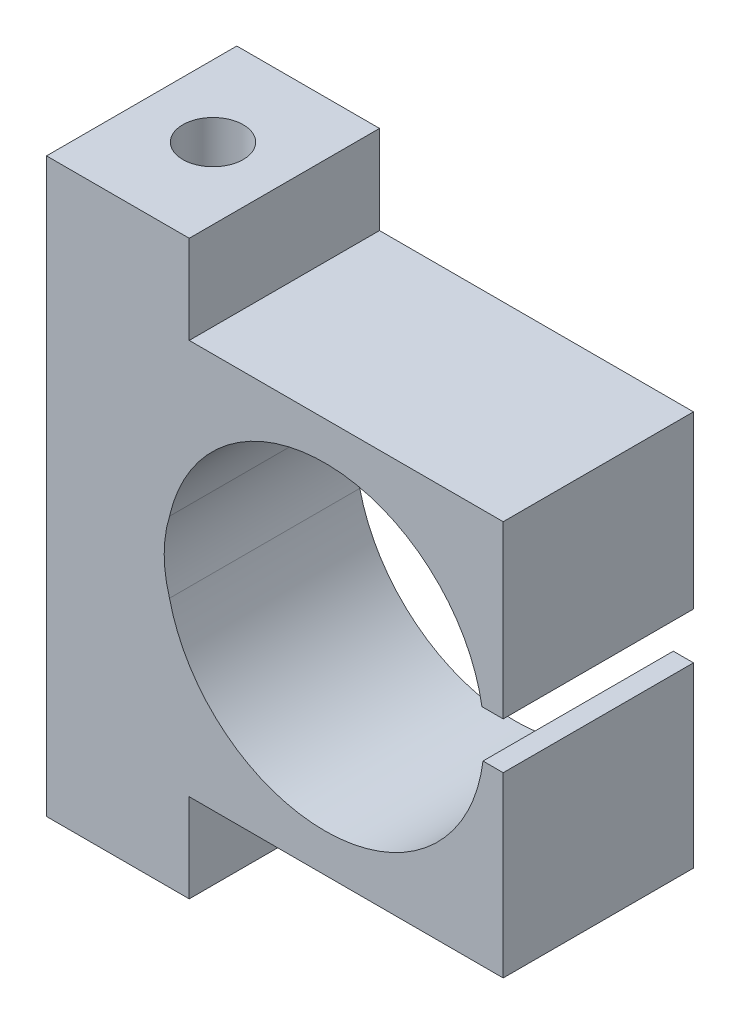
from build123d import *

# Parameters (mm, degrees)
CROQUIS1_W              = 40
CROQUIS1_H              = 50.135716494
SALIENTE_EXTRUIR1_DEPTH = 20
CROQUIS2_W              = 25
CROQUIS2_H              = 9.3
CORTAR_EXTRUIR1_DEPTH   = 41.703747176
CROQUIS3_W              = 25
CROQUIS3_H              = 9.3
CORTAR_EXTRUIR2_DEPTH   = 41.703747176
CORTAR_EXTRUIR3_DEPTH   = 41.703747176
CROQUIS5_W              = 12.7
CROQUIS5_H              = 20
TALADRO1_D              = 6.35
TALADRO1_DEPTH          = 15
TALADRO2_D              = 6.35
TALADRO2_DEPTH          = 15
CROQUIS11_W             = 20
CROQUIS11_H             = 12.953152015
CROQUIS11_H_2           = 13.688922843
SALIENTE_EXTRUIR2_DEPTH = 5
CROQUIS12_W             = 15
CROQUIS12_H             = 20
SALIENTE_EXTRUIR3_DEPTH = 5
CORTAR_EXTRUIR4_START   = -76
CROQUIS13_R             = 3.175
CORTAR_EXTRUIR4_DEPTH   = 76
CROQUIS14_W             = 15
CROQUIS14_H             = 20
SALIENTE_EXTRUIR4_DEPTH = 5
CROQUIS15_R             = 3.175
CORTAR_EXTRUIR5_DEPTH   = 72
CROQUIS16_W             = 30
CROQUIS16_H             = 20
SALIENTE_EXTRUIR5_DEPTH = 5
CROQUIS17_W             = 30
CROQUIS17_H             = 20
SALIENTE_EXTRUIR6_DEPTH = 5
CROQUIS20_W             = 20
CROQUIS20_H             = 17.953152015
CROQUIS20_H_2           = 18.688922843
SALIENTE_EXTRUIR7_DEPTH = 3
CROQUIS21_R             = 16.75
CORTAR_EXTRUIR8_DEPTH   = 43


with BuildPart() as part:
    # Croquis1 → Saliente-Extruir1 (new body)
    with BuildSketch(Plane(origin=(0, 0, 0), x_dir=(-1, 0, 0), z_dir=(0, 0, -1))):
        with Locations((5.067858247, 0)):
            Rectangle(CROQUIS1_W, CROQUIS1_H)
    extrude(amount=-SALIENTE_EXTRUIR1_DEPTH)

    # Croquis2 → Cortar-Extruir1 (cut, through all)
    with BuildSketch(Plane.XY.offset(20)):
        with Locations((2.432141753, -20.417858247)):
            Rectangle(CROQUIS2_W, CROQUIS2_H)
    extrude(amount=-CORTAR_EXTRUIR1_DEPTH, mode=Mode.SUBTRACT)

    # Croquis3 → Cortar-Extruir2 (cut, through all)
    with BuildSketch(Plane.XY.offset(20)):
        with Locations((2.432141753, 20.417858247)):
            Rectangle(CROQUIS3_W, CROQUIS3_H)
    extrude(amount=-CORTAR_EXTRUIR2_DEPTH, mode=Mode.SUBTRACT)

    # Croquis4 → Cortar-Extruir3 (cut, through all)
    with BuildSketch(Plane.XY.offset(20)):
        with BuildLine():
            Line((14.932141753, 2.814706232), (12.384160401, 2.814706232))
            ThreePointArc((12.384160401, 2.814706232), (12.694464867, 0.374915654), (12.528688183, -2.078935404))
            Line((12.528688183, -2.078935404), (14.932141753, -2.078935404))
            Line((14.932141753, -2.078935404), (14.932141753, 2.814706232))
        make_face()
    extrude(amount=-CORTAR_EXTRUIR3_DEPTH, mode=Mode.SUBTRACT)

    # Croquis5 → Cortar-Revolución1 (revolve, cut)
    with BuildSketch(Plane.XZ):
        with Locations((6.35, 10)):
            Rectangle(CROQUIS5_W, CROQUIS5_H)
    revolve(axis=Axis((0, 0, 20), (0, 0, -1)), mode=Mode.SUBTRACT)

    # Taladro1
    with Locations(Plane(origin=(0, -25.067858247, 0), x_dir=(-1, 0, 0), z_dir=(0, -1, 0))):
        with Locations((17.567858247, -9.999290914)):
            Hole(TALADRO1_D / 2, depth=TALADRO1_DEPTH)

    # Taladro2
    with Locations(Plane(origin=(0, 25.067858247, 0), x_dir=(1, 0, 0), z_dir=(0, 1, 0))):
        with Locations((-17.567858247, -10)):
            Hole(TALADRO2_D / 2, depth=TALADRO2_DEPTH)

    # Croquis11 → Saliente-Extruir2 (add)
    with BuildSketch(Plane(origin=(14.932141753, 0, 0), x_dir=(0, 0, -1), z_dir=(1, 0, 0))):
        with Locations((-10, 9.29128224)):
            Rectangle(CROQUIS11_W, CROQUIS11_H)
        with Locations((-10, -8.923396826)):
            Rectangle(CROQUIS11_W, CROQUIS11_H_2)
    extrude(amount=SALIENTE_EXTRUIR2_DEPTH)

    # Croquis12 → Saliente-Extruir3 (add)
    with BuildSketch(Plane(origin=(0, 25.067858247, 0), x_dir=(1, 0, 0), z_dir=(0, 1, 0))):
        with Locations((-17.567858247, -10)):
            Rectangle(CROQUIS12_W, CROQUIS12_H)
    extrude(amount=SALIENTE_EXTRUIR3_DEPTH)

    # Croquis13 → Cortar-Extruir4 (cut)
    with BuildSketch(Plane.XZ.offset(25.067858247).offset(CORTAR_EXTRUIR4_START)):
        with Locations(Location((-17.567858247, 9.999290914, 0), (0, 0, 270))):
            Circle(CROQUIS13_R)
    extrude(amount=CORTAR_EXTRUIR4_DEPTH, mode=Mode.SUBTRACT)

    # Croquis14 → Saliente-Extruir4 (add)
    with BuildSketch(Plane.XZ.offset(25.067858247)):
        with Locations((-17.567858247, 10)):
            Rectangle(CROQUIS14_W, CROQUIS14_H)
    extrude(amount=SALIENTE_EXTRUIR4_DEPTH)

    # Croquis15 → Cortar-Extruir5 (cut)
    with BuildSketch(Plane(origin=(0, 30.067858247, 0), x_dir=(1, 0, 0), z_dir=(0, 1, 0))):
        with Locations((-17.567858247, -9.999290914)):
            Circle(CROQUIS15_R)
    extrude(amount=-CORTAR_EXTRUIR5_DEPTH, mode=Mode.SUBTRACT)

    # Croquis16 → Saliente-Extruir5 (add)
    with BuildSketch(Plane(origin=(0, 15.767858247, 0), x_dir=(1, 0, 0), z_dir=(0, 1, 0))):
        with Locations((4.932141753, -10)):
            Rectangle(CROQUIS16_W, CROQUIS16_H)
    extrude(amount=SALIENTE_EXTRUIR5_DEPTH)

    # Croquis17 → Saliente-Extruir6 (add)
    with BuildSketch(Plane.XZ.offset(15.767858247)):
        with Locations((4.932141753, 10)):
            Rectangle(CROQUIS17_W, CROQUIS17_H)
    extrude(amount=SALIENTE_EXTRUIR6_DEPTH)

    # Croquis20 → Saliente-Extruir7 (add)
    with BuildSketch(Plane(origin=(19.932141753, 0, 0), x_dir=(0, 0, -1), z_dir=(1, 0, 0))):
        with Locations((-10, 11.79128224)):
            Rectangle(CROQUIS20_W, CROQUIS20_H)
        with Locations((-10, -11.423396826)):
            Rectangle(CROQUIS20_W, CROQUIS20_H_2)
    extrude(amount=SALIENTE_EXTRUIR7_DEPTH)

    # Croquis21 → Cortar-Extruir8 (cut)
    with BuildSketch(Plane.XY.offset(20)):
        with Locations((4.18967344, 0)):
            Circle(CROQUIS21_R)
    extrude(amount=-CORTAR_EXTRUIR8_DEPTH, mode=Mode.SUBTRACT)


solid = part.part
